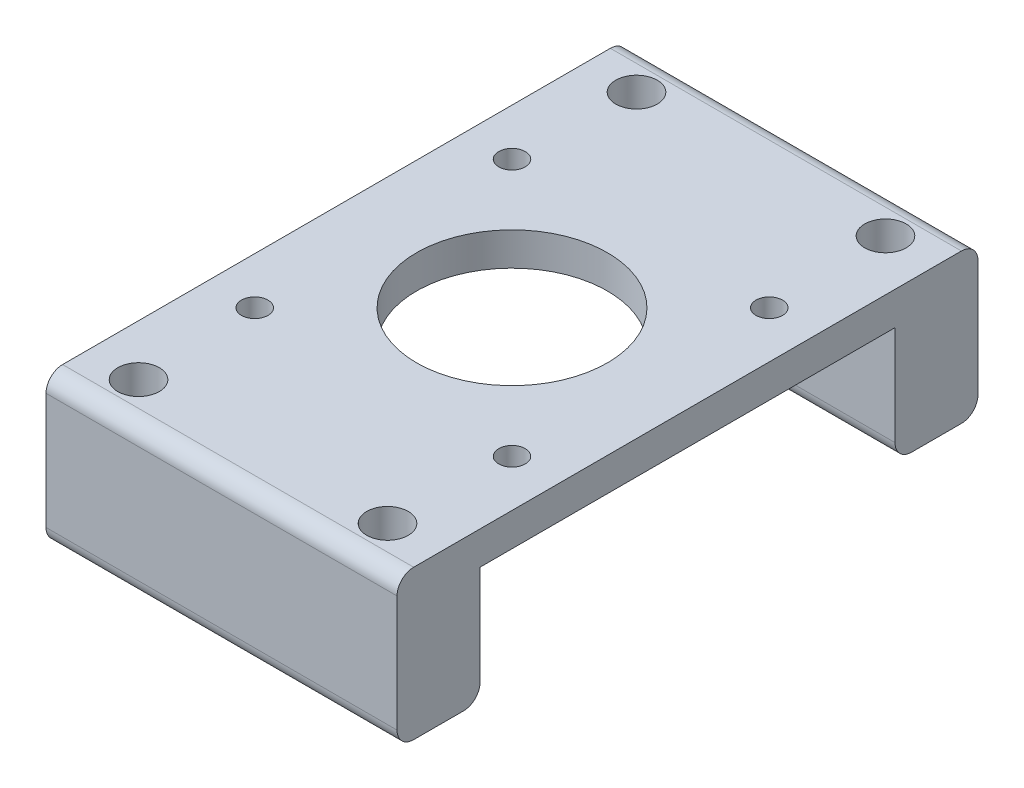
from build123d import *

# Parameters (mm, degrees)
ESBO_O1_W                 = 50
ESBO_O1_H                 = 4
RESSALTO_EXTRUS_O1_DEPTH  = 21.15
ESBO_O3_R                 = 11.5
CORTE_EXTRUS_O1_DEPTH     = 45.680224932
ESBO_O4_R                 = 1.6
CORTE_EXTRUS_O2_DEPTH     = 45.680224932
PADR_OCIRCULAR1_COUNT     = 4
ESBO_O5_R                 = 2.5
CORTE_EXTRUS_O3_DEPTH     = 45.680224932
ESPELHAR2_COPY_1_SKETCH_R = 2.5
ESPELHAR2_COPY_1_DEPTH    = 45.680224932
FILETE1_R                 = 2


with BuildPart() as part:
    # Esboço1 → Ressalto-extrusão1 (new, symmetric)
    with BuildSketch(Plane(origin=(0, 0, 0), x_dir=(0, 0, -1), z_dir=(1, 0, 0))):
        Polygon((-25, -2), (-25, 2), (-35, 2), (-35, -16), (-25, -16), align=None)
        Rectangle(ESBO_O1_W, ESBO_O1_H)
        Polygon((35, 2), (25, 2), (25, -2), (25, -16), (35, -16), align=None)
    extrude(amount=RESSALTO_EXTRUS_O1_DEPTH, both=True)

    # Esboço3 → Corte-extrusão1 (cut, through all)
    with BuildSketch(Plane(origin=(0, 2, 0), x_dir=(1, 0, 0), z_dir=(0, 1, 0))):
        with Locations(Location((0, 0, 0), (0, 0, 270))):
            Circle(ESBO_O3_R)
    extrude(amount=-CORTE_EXTRUS_O1_DEPTH, mode=Mode.SUBTRACT)

    # Esboço4 → Corte-extrusão2 (cut, through all)
    with BuildSketch(Plane(origin=(0, 2, 0), x_dir=(1, 0, 0), z_dir=(0, 1, 0))):
        with Locations(Location((-15.5, 15.5, 0), (0, 0, 270))):
            Circle(ESBO_O4_R)
    corte_extrus_o2 = extrude(amount=-CORTE_EXTRUS_O2_DEPTH, mode=Mode.SUBTRACT)

    # PadrãoCircular1: Corte-extrusão2 ×4 about axis
    padr_ocircular1_axis = Axis((0, 0, 0), (0, 1, 0))
    for i in range(1, PADR_OCIRCULAR1_COUNT):
        add(corte_extrus_o2.rotate(padr_ocircular1_axis, i * 360 / PADR_OCIRCULAR1_COUNT), mode=Mode.SUBTRACT)

    # Esboço5 → Corte-extrusão3 (cut, through all)
    with BuildSketch(Plane.XZ.offset(16)):
        with Locations(Location((15, -30, 0), (0, 0, 270))):
            Circle(ESBO_O5_R)
    corte_extrus_o3 = extrude(amount=-CORTE_EXTRUS_O3_DEPTH, mode=Mode.SUBTRACT)

    # Espelhar1: Corte-extrusão3 across plane
    add(corte_extrus_o3.mirror(Plane(origin=(0, 0, 0), x_dir=(0, 0, 1), z_dir=(1, 0, 0))), mode=Mode.SUBTRACT)

    # Espelhar2: Corte-extrusão3 across plane
    add(corte_extrus_o3.mirror(Plane.XY), mode=Mode.SUBTRACT)

    # Espelhar2 copy 1 sketch → Espelhar2 copy 1 (cut, through all)
    with BuildSketch(Plane(origin=(0, -16, 0), x_dir=(-1, 0, 0), z_dir=(0, -1, 0))):
        with Locations(Location((15, -30, 0), (0, 0, 270))):
            Circle(ESPELHAR2_COPY_1_SKETCH_R)
    extrude(amount=-ESPELHAR2_COPY_1_DEPTH, mode=Mode.SUBTRACT)

    # Filete1
    filete1_edges = [part.edges().sort_by_distance(p)[0] for p in [
        (0, 2, -35),
        (0, -16, -35),
        (0, -16, -25),
        (0, -16, 25),
        (0, -16, 35),
        (0, 2, 35),
    ]]
    fillet(filete1_edges, radius=FILETE1_R)


solid = part.part
